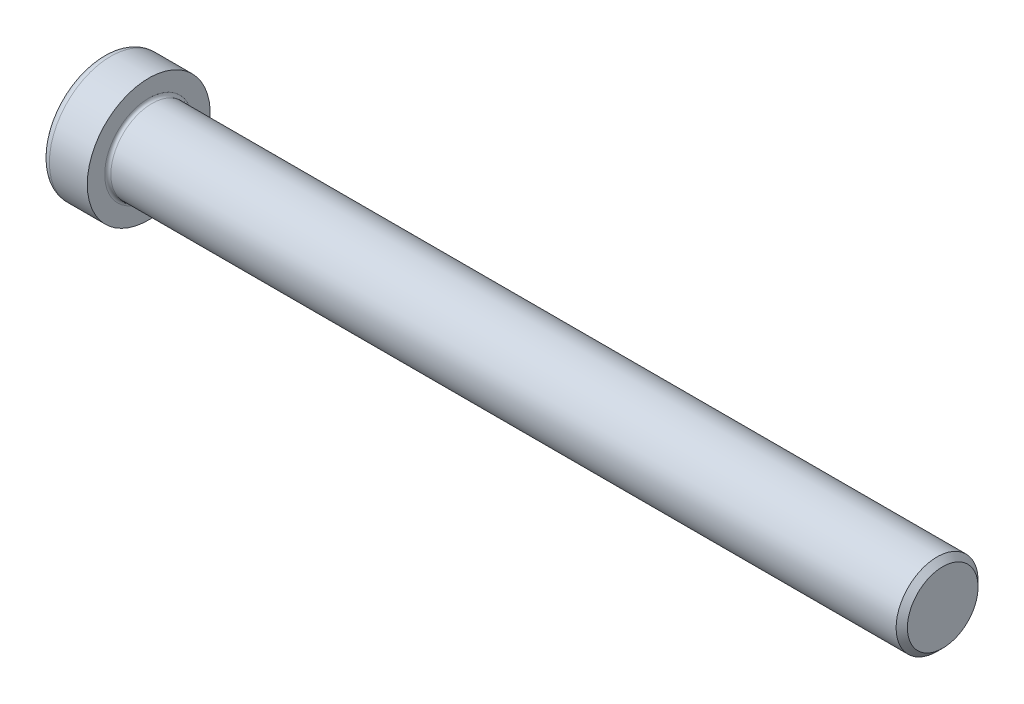
from build123d import *

# Parameters (mm, degrees)
FILLET1_R   = 0.6
FILLET2_R   = 1.6
HEX_2_DEPTH = 5.5


with BuildPart() as part:
    # BodySke → Base-Revolve (revolve)
    with BuildSketch(Plane.XY, mode=Mode.PRIVATE) as base_revolve_sk:
        Polygon((0, 0), (0, 12), (9, 12), (9, 8), (162.8985, 8), (164, 6.8985), (164, 0), align=None)
    revolve(base_revolve_sk.sketch.rotate(Axis((-31.75, 0, 0), (1, 0, 0)), 90), axis=Axis((-31.75, 0, 0), (1, 0, 0)))

    # Fillet1
    fillet1_edges = [part.edges().sort_by_distance(p)[0] for p in [
        (9, 0, -8),
    ]]
    fillet(fillet1_edges, radius=FILLET1_R)

    # Fillet2
    fillet2_edges = [part.edges().sort_by_distance(p)[0] for p in [
        (0, 0, -12),
    ]]
    fillet(fillet2_edges, radius=FILLET2_R)

    # Sketch2 → Hex-PreBroach (revolve, cut)
    with BuildSketch(Plane.XY, mode=Mode.PRIVATE) as hex_prebroach_sk:
        Polygon((0, 6), (5.5, 6), (8.964101615, 0), (0, 0), align=None)
    revolve(hex_prebroach_sk.sketch.rotate(Axis((0, 0, 0), (1, 0, 0)), 90), axis=Axis((0, 0, 0), (1, 0, 0)), mode=Mode.SUBTRACT)

    # Sketch3 → Hex 2 (cut)
    with BuildSketch(Plane(origin=(0, 0, 0), x_dir=(0, 0.500000000000001, 0.866025403784438), z_dir=(-1, 0, 0))):
        Polygon((3.464101615, 6), (-3.464101615, 6), (-6.92820323, 0), (-3.464101615, -6), (3.464101615, -6), (6.92820323, 0), align=None)
    extrude(amount=-HEX_2_DEPTH, mode=Mode.SUBTRACT)


solid = part.part
